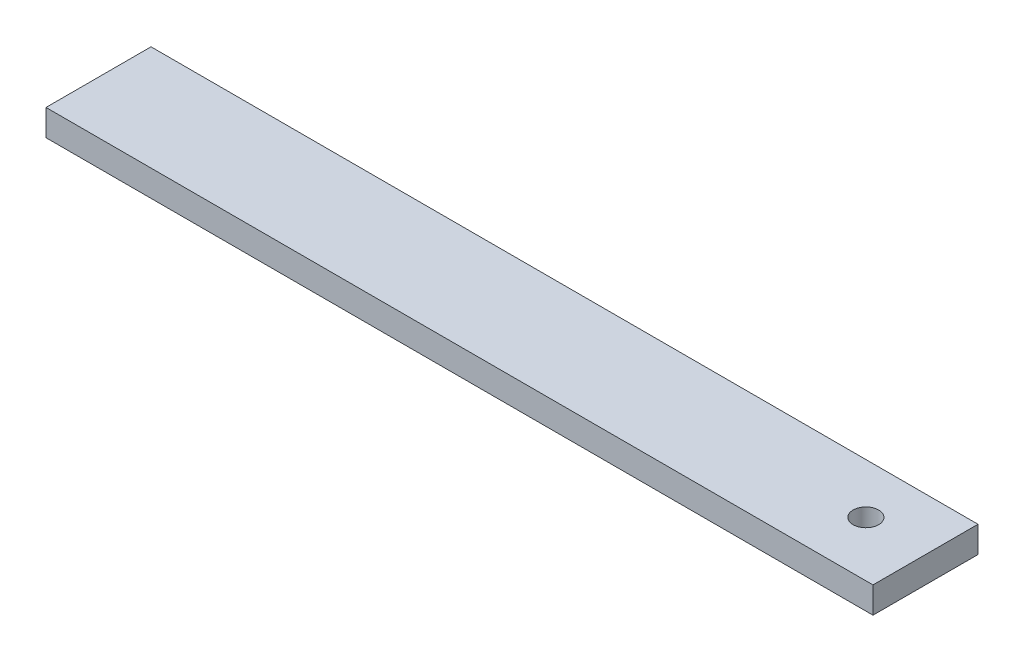
from build123d import *

# Parameters (mm, degrees)
SKETCH1_W           = 100
SKETCH1_H           = 12.7
SKETCH1_R           = 1.543638368
BOSS_EXTRUDE1_DEPTH = 3.175


with BuildPart() as part:
    # Sketch1 → Boss-Extrude1 (new body)
    with BuildSketch(Plane(origin=(0, 0, 0), x_dir=(1, 0, 0), z_dir=(0, 1, 0))):
        with Locations((50, 6.35)):
            Rectangle(SKETCH1_W, SKETCH1_H)
        with Locations(Location((92.500362967, 6.645925942, 0), (0, 0, 270))):
            Circle(SKETCH1_R, mode=Mode.SUBTRACT)
    extrude(amount=BOSS_EXTRUDE1_DEPTH)


solid = part.part
